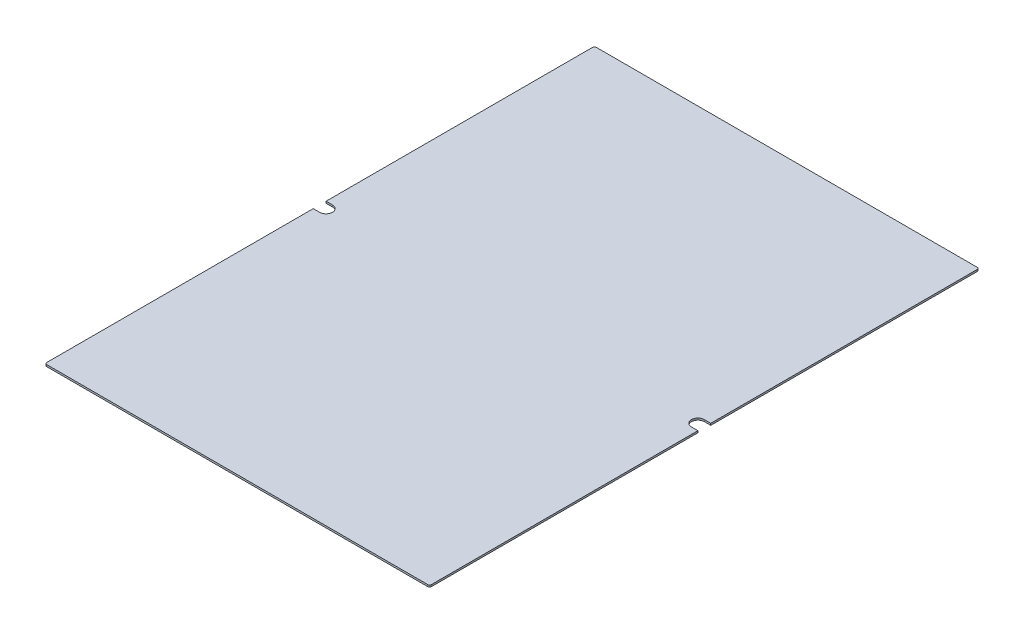
from build123d import *

# Parameters (mm, degrees)
SALIENTE_EXTRUIR1_DEPTH = 1
REDONDEO1_R             = 1


with BuildPart() as part:
    # Croquis1 → Saliente-Extruir1 (new body)
    with BuildSketch(Plane(origin=(0, 0, 0), x_dir=(1, 0, 0), z_dir=(0, 1, 0))):
        with BuildLine():
            Line((0, 0), (210, 0))
            Line((210, 0), (210, 146.5))
            Line((210, 146.5), (206.5, 146.5))
            ThreePointArc((206.5, 146.5), (203, 150), (206.5, 153.5))
            Line((206.5, 153.5), (210, 153.5))
            Line((210, 153.5), (210, 300))
            Line((210, 300), (0, 300))
            Line((0, 300), (0, 153.5))
            Line((0, 153.5), (3.5, 153.5))
            ThreePointArc((3.5, 153.5), (7, 150), (3.5, 146.5))
            Line((3.5, 146.5), (0, 146.5))
            Line((0, 146.5), (0, 0))
        make_face()
    extrude(amount=SALIENTE_EXTRUIR1_DEPTH)

    # Redondeo1
    redondeo1_edges = [part.edges().sort_by_distance(p)[0] for p in [
        (0, 0.5, -300),
        (210, 0.5, -300),
        (210, 0.5, 0),
        (0, 0.5, 0),
    ]]
    fillet(redondeo1_edges, radius=REDONDEO1_R)


solid = part.part
